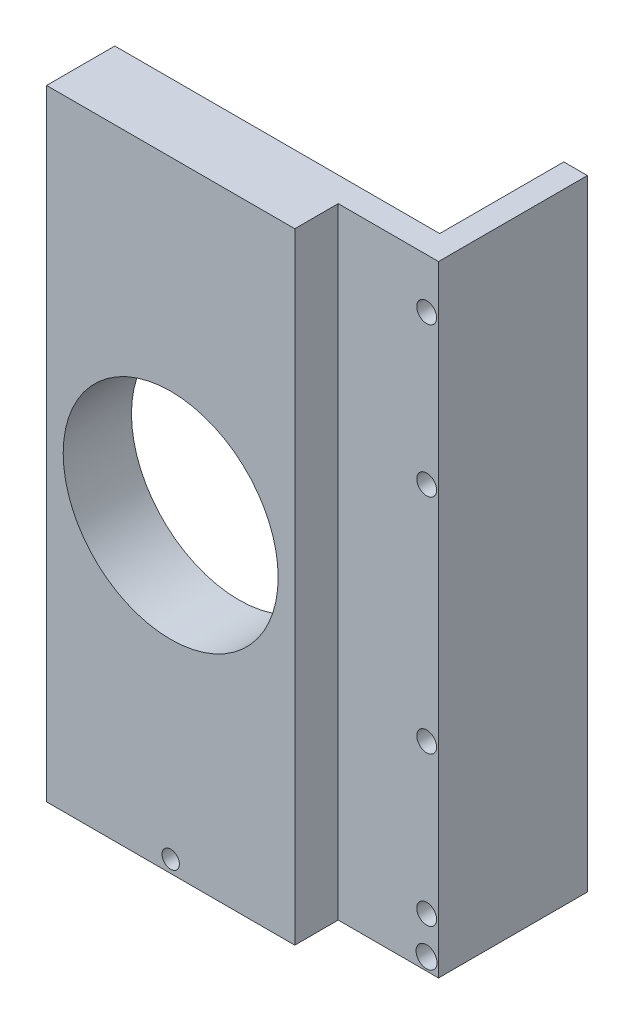
from build123d import *

# Parameters (mm, degrees)
SKETCH1_R             = 1.016
BOSS_EXTRUDE1_DEPTH   = 15.24
BOSS_EXTRUDE1_2_DEPTH = 15.24
SKETCH2_W             = 33.244360662
SKETCH2_H             = 63.5
BOSS_EXTRUDE2_DEPTH   = 2.54
SKETCH3_W             = 38.1
SKETCH3_H             = 15.24
BOSS_EXTRUDE3_DEPTH   = 2.54
SKETCH4_R             = 1.016
CUT_EXTRUDE1_DEPTH    = 41.040262237
SKETCH5_R             = 1.071714946
CUT_EXTRUDE2_DEPTH    = 41.040262237
SKETCH6_R             = 11.0000034
CUT_EXTRUDE4_DEPTH    = 41.040262237
BOSS_EXTRUDE4_START   = 4.445
SKETCH7_W             = 25.4
SKETCH7_H             = 63.5
SKETCH7_R             = 11.0000034
BOSS_EXTRUDE4_DEPTH   = 4.445
SKETCH8_W             = 35.681993508
SKETCH8_H             = 2.54
CUT_EXTRUDE5_DEPTH    = 12.7
SKETCH9_R             = 0.889
CUT_EXTRUDE6_DEPTH    = 12.7


with BuildPart() as part:
    # Sketch1 → Boss-Extrude1 (new body)
    with BuildSketch(Plane.XY):
        Polygon((19.05, 0), (19.05, 31.75), (17.840996754, 31.75), (16.631993508, 31.75), (16.631993508, -31.75), (19.05, -31.75), align=None)
        with Locations((17.840996754, -26.657844962)):
            Circle(SKETCH1_R, mode=Mode.SUBTRACT)
        with Locations((17.840996754, -11.385809707)):
            Circle(SKETCH1_R, mode=Mode.SUBTRACT)
        with Locations((17.840996754, 11.385809707)):
            Circle(SKETCH1_R, mode=Mode.SUBTRACT)
        with BuildLine():
            ThreePointArc((17.840996754, 25.641844962), (16.824996754, 26.657844962), (17.840996754, 27.673844962))
            ThreePointArc((17.840996754, 27.673844962), (18.856996754, 26.657844962), (17.840996754, 25.641844962))
        make_face(mode=Mode.SUBTRACT)
    extrude(amount=-BOSS_EXTRUDE1_DEPTH)

    # Sketch2 → Boss-Extrude2 (add)
    with BuildSketch(Plane.XY):
        with Locations((0.009813177, 0)):
            Rectangle(SKETCH2_W, SKETCH2_H)
    extrude(amount=-BOSS_EXTRUDE2_DEPTH)

    # Sketch3 → Boss-Extrude3 (add)
    with BuildSketch(Plane.XZ.offset(31.75)):
        with Locations((0, -7.62)):
            Rectangle(SKETCH3_W, SKETCH3_H)
    extrude(amount=-BOSS_EXTRUDE3_DEPTH)

    # Sketch5 → Cut-Extrude2 (cut, through all)
    with BuildSketch(Plane.XY):
        with Locations((-17.827792249, -30.48)):
            Circle(SKETCH5_R)
        with Locations((17.827792249, -30.48)):
            Circle(SKETCH5_R)
    extrude(amount=-CUT_EXTRUDE2_DEPTH, mode=Mode.SUBTRACT)

    # Sketch6 → Cut-Extrude4 (cut, through all)
    with BuildSketch(Plane.XY):
        with Locations((-3.912367154, 0)):
            Circle(SKETCH6_R)
    extrude(amount=-CUT_EXTRUDE4_DEPTH, mode=Mode.SUBTRACT)

    # Sketch7 → Boss-Extrude4 (add)
    with BuildSketch(Plane.XY.offset(BOSS_EXTRUDE4_START)):
        with Locations((-3.912367154, 0)):
            Rectangle(SKETCH7_W, SKETCH7_H)
        with Locations((-3.912367154, 0)):
            Circle(SKETCH7_R, mode=Mode.SUBTRACT)
    extrude(amount=-BOSS_EXTRUDE4_DEPTH)

    # Sketch8 → Cut-Extrude5 (cut)
    with BuildSketch(Plane(origin=(0, 0, -15.24), x_dir=(-1, 0, 0), z_dir=(0, 0, -1))):
        with Locations((1.209003246, -30.48)):
            Rectangle(SKETCH8_W, SKETCH8_H)
    extrude(amount=-CUT_EXTRUDE5_DEPTH, mode=Mode.SUBTRACT)

    # Sketch9 → Cut-Extrude6 (cut)
    with BuildSketch(Plane.XY.offset(4.445)):
        with Locations((-3.912367154, -30.48)):
            Circle(SKETCH9_R)
    extrude(amount=-CUT_EXTRUDE6_DEPTH, mode=Mode.SUBTRACT)


with BuildPart() as body_2:
    # Sketch1 → Boss-Extrude1 2 (new body)
    with BuildSketch(Plane.XY):
        with Locations((-17.840996754, -26.657844962)):
            Circle(SKETCH1_R)
    extrude(amount=-BOSS_EXTRUDE1_2_DEPTH)

    # Sketch4 → Cut-Extrude1 (cut, through all)
    with BuildSketch(Plane.XY):
        with Locations((-17.840996754, -26.657844962)):
            Circle(SKETCH4_R)
    extrude(amount=-CUT_EXTRUDE1_DEPTH, mode=Mode.SUBTRACT)


solid = part.part
